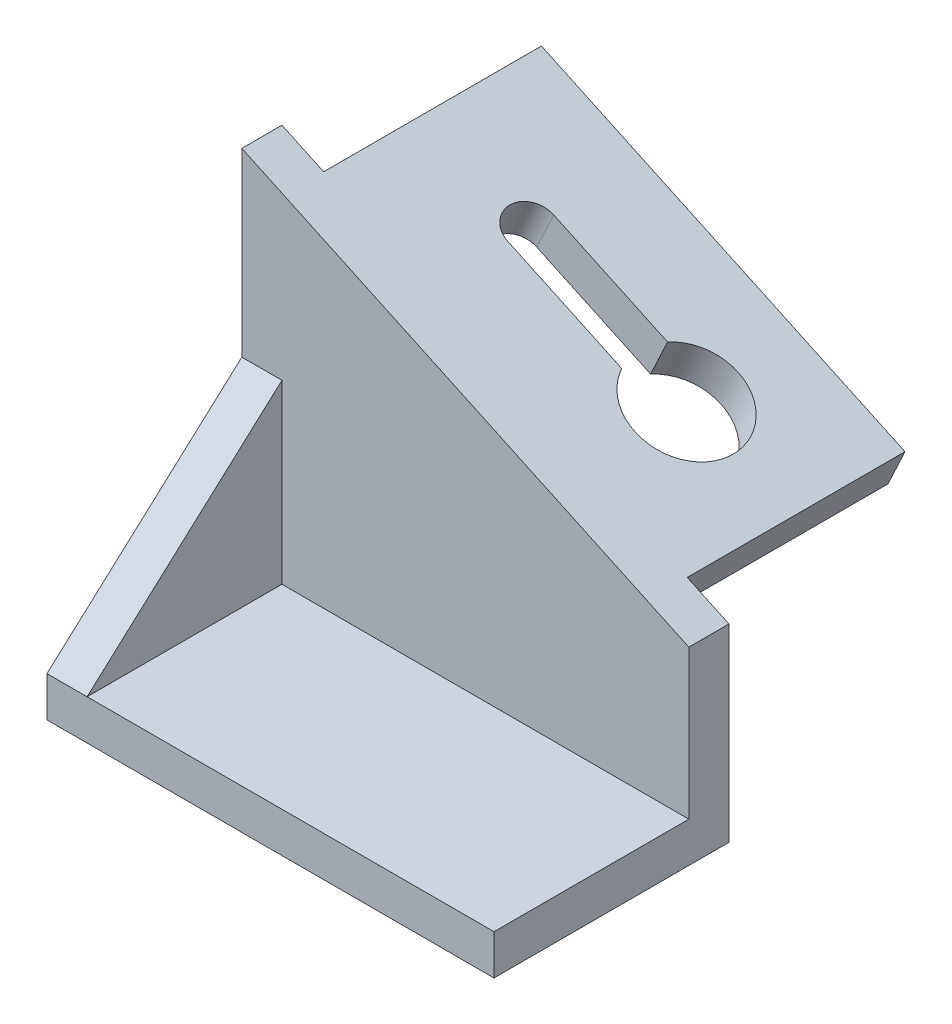
from build123d import *

# Parameters (mm, degrees)
SKETCH1_W           = 78
SKETCH1_H           = 34
BOSS_EXTRUDE1_DEPTH = 7
BOSS_EXTRUDE2_DEPTH = 7
BOSS_EXTRUDE3_DEPTH = 7
SKETCH6_W           = 70
SKETCH6_H           = 38
BOSS_EXTRUDE4_DEPTH = 7
CUT_EXTRUDE1_DEPTH  = 7


with BuildPart() as part:
    # Sketch1 → Boss-Extrude1 (new body)
    with BuildSketch(Plane(origin=(0, 0, 0), x_dir=(1, 0, 0), z_dir=(0, 1, 0))):
        Rectangle(SKETCH1_W, SKETCH1_H)
    extrude(amount=BOSS_EXTRUDE1_DEPTH)

    # Sketch3 → Boss-Extrude2 (add)
    with BuildSketch(Plane.ZY.offset(39)):
        Polygon((17, 7), (-17, 37.819553073), (-17, 7), align=None)
    extrude(amount=-BOSS_EXTRUDE2_DEPTH)

    # Sketch4 → Boss-Extrude3 (add)
    with BuildSketch(Plane(origin=(0, 0, -17), x_dir=(-1, 0, 0), z_dir=(0, 0, -1))):
        Polygon((-39, 0), (-39, 33), (39, 69.371997336), (39, 0), align=None)
    extrude(amount=BOSS_EXTRUDE3_DEPTH)

    # Sketch6 → Boss-Extrude4 (add)
    with BuildSketch(Plane(origin=(19.605374923, 42.043862201, 0), x_dir=(0.9063077870366493, -0.4226182617407009, 0), z_dir=(0.4226182617407009, 0.9063077870366493, 0))):
        with Locations((-21.632137783, 43)):
            Rectangle(SKETCH6_W, SKETCH6_H)
    extrude(amount=-BOSS_EXTRUDE4_DEPTH)

    # Sketch7 → Cut-Extrude1 (cut)
    with BuildSketch(Plane(origin=(19.605374923, 42.043862201, 0), x_dir=(0.9063077870366493, -0.4226182617407009, 0), z_dir=(0.4226182617407009, 0.9063077870366493, 0))):
        with BuildLine():
            Line((-14.694395531, 38), (-36.632137783, 38))
            ThreePointArc((-36.632137783, 38), (-40.632137783, 42), (-36.632137783, 46))
            Line((-36.632137783, 46), (-14.694395531, 46))
            ThreePointArc((-14.694395531, 46), (2.367862217, 42), (-14.694395531, 38))
        make_face()
    extrude(amount=-CUT_EXTRUDE1_DEPTH, mode=Mode.SUBTRACT)


solid = part.part
